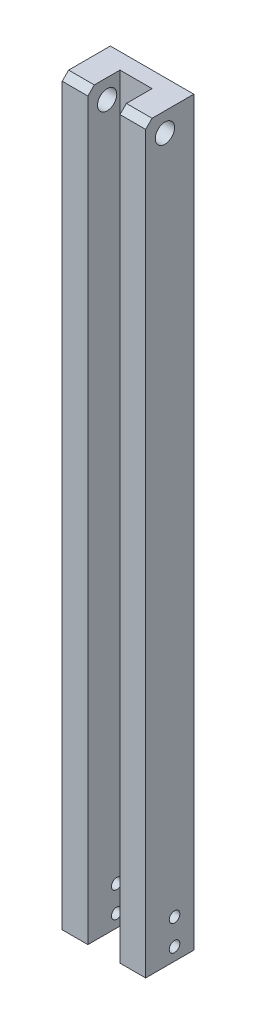
from build123d import *

# Parameters (mm, degrees)
EXTRUDE_1_DEPTH     = 231
SKETCH_2_R          = 3
CUT_EXTRUDE_1_DEPTH = 233.579556281
HOLE_WIZARD_M4_1_D  = 3.3
CHAMFER_1_SIZE      = 2
CUT_EXTRUDE_3_REACH = 233.582
SKETCH_8_W          = 10
SKETCH_8_H          = 168.002742078


with BuildPart() as part:
    # 草图1 → 凸台-拉伸1 (new body)
    with BuildSketch(Plane(origin=(0, 0, 0), x_dir=(1, 0, 0), z_dir=(0, 1, 0))):
        Polygon((-13, -7.5), (-5, -7.5), (-5, 2.5), (5, 2.5), (5, -7.5), (13, -7.5), (13, 7.5), (-13, 7.5), align=None)
    extrude(amount=-EXTRUDE_1_DEPTH)

    # 草图2 → 切除-拉伸1 (cut, through all)
    with BuildSketch(Plane(origin=(13, 0, 0), x_dir=(0, 0, -1), z_dir=(1, 0, 0))):
        with Locations((-1.5, -6)):
            Circle(SKETCH_2_R)
    extrude(amount=-CUT_EXTRUDE_1_DEPTH, mode=Mode.SUBTRACT)

    # M4 螺纹孔1 (through all)
    with Locations(Plane.ZY.offset(13)):
        with Locations((-1.5, -227), (-1.5, -219)):
            Hole(HOLE_WIZARD_M4_1_D / 2)

    # 倒角1
    chamfer_1_edges = [part.edges().sort_by_distance(p)[0] for p in [
        (9, 0, 7.5),
        (-9, 0, 7.5),
    ]]
    chamfer(chamfer_1_edges, length=CHAMFER_1_SIZE)

    # 草图8 → 切除-拉伸3 (cut, up to next)
    with BuildSketch(Plane.XY.offset(-2.5), mode=Mode.PRIVATE) as cut_extrude_3_sk1:
        with Locations((0, -151.451371039)):
            Rectangle(SKETCH_8_W, SKETCH_8_H)
    cut_extrude_3_tool1 = extrude(cut_extrude_3_sk1.sketch, amount=-CUT_EXTRUDE_3_REACH, mode=Mode.PRIVATE) & part.part
    add(cut_extrude_3_tool1.solids().sort_by_distance((0, -151.451371, -2.5))[0], mode=Mode.SUBTRACT)


solid = part.part
